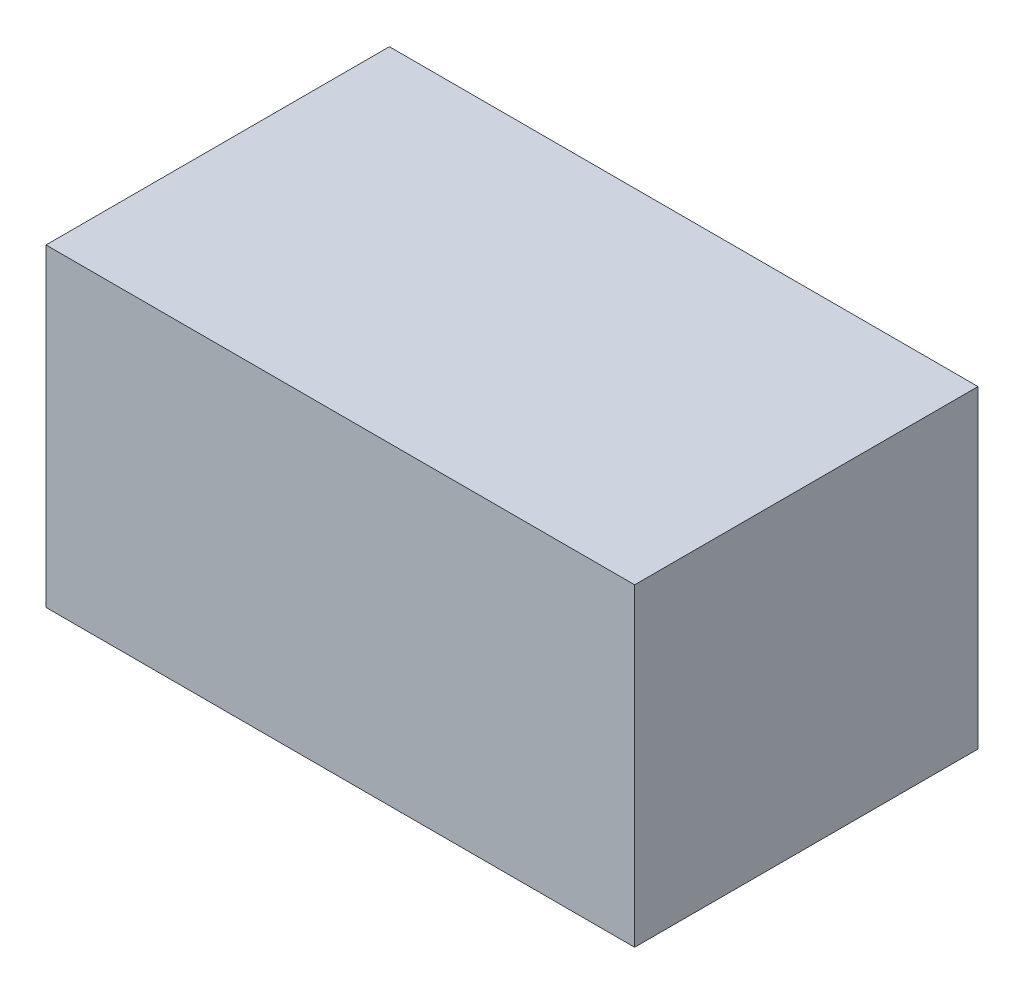
from build123d import *

# Parameters (mm, degrees)
SKETCH1_W      = 18
SKETCH1_H      = 9.6
EXTRUDE1_DEPTH = 10.5


with BuildPart() as part:
    # Sketch1 → Extrude1 (new body)
    with BuildSketch(Plane.XY):
        with Locations((9, -4.8)):
            Rectangle(SKETCH1_W, SKETCH1_H)
    extrude(amount=EXTRUDE1_DEPTH)


solid = part.part
